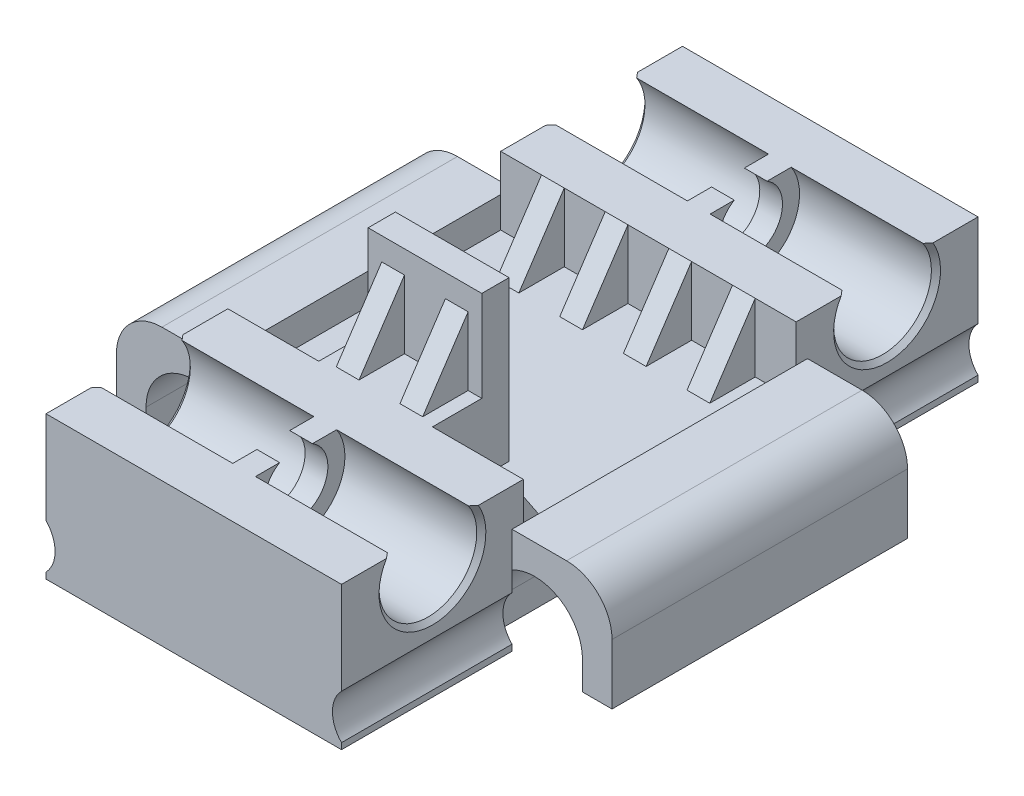
from build123d import *

# Parameters (mm, degrees)
SKETCH_1_W           = 65
SKETCH_1_H           = 140
EXTRUDE_1_DEPTH      = 31.5
SKETCH_2_R           = 10.75
CUT_EXTRUDE_1_DEPTH  = 30
CUT_EXTRUDE_START    = -30
SKETCH_3_R           = 10.75
CUT_EXTRUDE_2_DEPTH  = 30
CHAMFER_1_SIZE       = 1
CHAMFER_2_SIZE       = 1
SKETCH_4_W           = 25
SKETCH_4_H           = 6
EXTRUDE_2_DEPTH      = 20
EXTRUDE_4_DEPTH      = 2.5
EXTRUDE_5_DEPTH      = 2.5
CUT_EXTRUDE_3_DEPTH  = 15
EXTRUDE_6_DEPTH      = 2.5
EXTRUDE_7_DEPTH      = 2.5
EXTRUDE_8_DEPTH      = 2.5
EXTRUDE_9_DEPTH      = 2.5
EXTRUDE_10_DEPTH     = 5
EXTRUDE_11_DEPTH     = 5
SKETCH_18_R          = 7
CUT_EXTRUDE_7_DEPTH  = 94.686978818
SKETCH_19_W          = 65.000437226
SKETCH_19_H          = 23.25
EXTRUDE_12_DEPTH     = 22
SKETCH_20_W          = 65.000437226
SKETCH_20_H          = 23.25
EXTRUDE_13_DEPTH     = 22
CUT_EXTRUDE_8_DEPTH  = 30
SKETCH_22_R          = 7
CUT_EXTRUDE_9_DEPTH  = 159.815931191
CUT_EXTRUDE_10_DEPTH = 30
FILLET_7_R           = 10


with BuildPart() as part:
    # 草图1 → 凸台-拉伸1 (new body)
    with BuildSketch(Plane(origin=(0, 0, 0), x_dir=(1, 0, 0), z_dir=(0, 1, 0))):
        Rectangle(SKETCH_1_W, SKETCH_1_H)
    extrude(amount=EXTRUDE_1_DEPTH)

    # 草图2 → 切除-拉伸1 (cut)
    with BuildSketch(Plane.ZY.offset(32.5)):
        with Locations((-50, 25.5)):
            Circle(SKETCH_2_R)
        with Locations((50, 25.5)):
            Circle(SKETCH_2_R)
    extrude(amount=-CUT_EXTRUDE_1_DEPTH, mode=Mode.SUBTRACT)

    # 草图3 → 切除-拉伸2 (cut)
    with BuildSketch(Plane(origin=(32.5, 0, 0), x_dir=(0, 0, -1), z_dir=(1, 0, 0)).offset(CUT_EXTRUDE_START)):
        with Locations((-50, 25.5)):
            Circle(SKETCH_3_R)
        with Locations((50, 25.5)):
            Circle(SKETCH_3_R)
    extrude(amount=CUT_EXTRUDE_2_DEPTH, mode=Mode.SUBTRACT)

    # 倒角1
    chamfer_1_edges = [part.edges().sort_by_distance(p)[0] for p in [
        (32.5, 14.75, 50),
    ]]
    chamfer(chamfer_1_edges, length=CHAMFER_1_SIZE)

    # 倒角2
    chamfer_2_edges = [part.edges().sort_by_distance(p)[0] for p in [
        (-32.5, 14.75, -50),
        (-32.5, 14.75, 50),
        (32.5, 14.75, -50),
    ]]
    chamfer(chamfer_2_edges, length=CHAMFER_2_SIZE)

    # 草图4 → 凸台-拉伸2 (add)
    with BuildSketch(Plane(origin=(0, 31.5, 0), x_dir=(1, 0, 0), z_dir=(0, 1, 0))):
        with Locations((0, -16.15)):
            Rectangle(SKETCH_4_W, SKETCH_4_H)
    extrude(amount=EXTRUDE_2_DEPTH)

    # 草图7 → 凸台-拉伸4 (add, symmetric)
    with BuildSketch(Plane(origin=(7, 0, 0), x_dir=(0, 0, -1), z_dir=(1, 0, 0))):
        Polygon((-19.15, 46.5), (-19.15, 31.5), (-29.15, 31.5), align=None)
    extrude(amount=EXTRUDE_4_DEPTH, both=True)

    # 草图8 → 凸台-拉伸5 (add, symmetric)
    with BuildSketch(Plane(origin=(-7, 0, 0), x_dir=(0, 0, -1), z_dir=(1, 0, 0))):
        Polygon((-19.15, 46.5), (-19.15, 31.5), (-29.15, 31.5), align=None)
    extrude(amount=EXTRUDE_5_DEPTH, both=True)

    # 草图9 → 切除-拉伸3 (cut)
    with BuildSketch(Plane(origin=(0, 31.5, 0), x_dir=(1, 0, 0), z_dir=(0, 1, 0))):
        Polygon((-32.5, 30.000218613), (32.5, 30.000218613), (32.5, -13.15), (32.5, -30.000218613), (12.5, -30.000218613), (12.5, -13.15), (-12.5, -13.15), (-12.5, -30.000218613), (-32.5, -30.000218613), (-32.5, -13.15), align=None)
    extrude(amount=-CUT_EXTRUDE_3_DEPTH, mode=Mode.SUBTRACT)

    # 草图11 → 凸台-拉伸6 (add, symmetric)
    with BuildSketch(Plane(origin=(7, 0, 0), x_dir=(0, 0, -1), z_dir=(1, 0, 0))):
        Polygon((30.000218613, 31.5), (30.000218613, 16.5), (20.000218613, 16.5), align=None)
    extrude(amount=EXTRUDE_6_DEPTH, both=True)

    # 草图13 → 凸台-拉伸7 (add, symmetric)
    with BuildSketch(Plane(origin=(21, 0, 0), x_dir=(0, 0, -1), z_dir=(1, 0, 0))):
        Polygon((30.000218613, 31.5), (30.000218613, 16.5), (20.000218613, 16.5), align=None)
    extrude(amount=EXTRUDE_7_DEPTH, both=True)

    # 草图12 → 凸台-拉伸8 (add, symmetric)
    with BuildSketch(Plane(origin=(-7, 0, 0), x_dir=(0, 0, -1), z_dir=(1, 0, 0))):
        Polygon((30.000218613, 31.5), (30.000218613, 16.5), (20.000218613, 16.5), align=None)
    extrude(amount=EXTRUDE_8_DEPTH, both=True)

    # 草图14 → 凸台-拉伸9 (add, symmetric)
    with BuildSketch(Plane(origin=(-21, 0, 0), x_dir=(0, 0, -1), z_dir=(1, 0, 0))):
        Polygon((30.000218613, 31.5), (30.000218613, 16.5), (20.000218613, 16.5), align=None)
    extrude(amount=EXTRUDE_9_DEPTH, both=True)

    # 草图15 → 凸台-拉伸10 (add)
    with BuildSketch(Plane(origin=(-21, 0, 0), x_dir=(0, 0, -1), z_dir=(1, 0, 0))):
        Polygon((-30.000218613, 31.5), (-30.000218613, 16.5), (-20.000218613, 16.5), align=None)
    extrude(amount=-EXTRUDE_10_DEPTH)

    # 草图16 → 凸台-拉伸11 (add)
    with BuildSketch(Plane(origin=(21, 0, 0), x_dir=(0, 0, -1), z_dir=(1, 0, 0))):
        Polygon((-30.000218613, 31.5), (-30.000218613, 16.5), (-20.000218613, 16.5), align=None)
    extrude(amount=EXTRUDE_11_DEPTH)

    # 草图18 → 切除-拉伸7 (cut, through all)
    with BuildSketch(Plane.ZY.offset(2.5)):
        with Locations((50, 25.5)):
            Circle(SKETCH_18_R)
        with Locations((-50, 25.5)):
            Circle(SKETCH_18_R)
    extrude(amount=-CUT_EXTRUDE_7_DEPTH, mode=Mode.SUBTRACT)

    # 草图19 → 凸台-拉伸12 (add)
    with BuildSketch(Plane(origin=(32.5, 0, 0), x_dir=(0, 0, -1), z_dir=(1, 0, 0))):
        with Locations((0, 11.625)):
            Rectangle(SKETCH_19_W, SKETCH_19_H)
    extrude(amount=EXTRUDE_12_DEPTH)

    # 草图20 → 凸台-拉伸13 (add)
    with BuildSketch(Plane.ZY.offset(32.5)):
        with Locations((0, 11.625)):
            Rectangle(SKETCH_20_W, SKETCH_20_H)
    extrude(amount=EXTRUDE_13_DEPTH)

    # 草图21 → 切除-拉伸8 (cut)
    with BuildSketch(Plane.XY.offset(32.500218613)):
        with BuildLine():
            Line((-48, 6.25), (-48, 0))
            Line((-48, 0), (-27, 0))
            Line((-27, 0), (-27, 6.25))
            ThreePointArc((-27, 6.25), (-37.5, 16.75), (-48, 6.25))
        make_face()
        with BuildLine():
            Line((27, 6.25), (27, 0))
            Line((27, 0), (48, 0))
            Line((48, 0), (48, 6.25))
            ThreePointArc((48, 6.25), (37.5, 16.75), (27, 6.25))
        make_face()
    extrude(amount=-CUT_EXTRUDE_8_DEPTH, mode=Mode.SUBTRACT)

    # 草图22 → 切除-拉伸9 (cut, through all)
    with BuildSketch(Plane.XY.offset(70)):
        with Locations((-37.5, 6.25)):
            Circle(SKETCH_22_R)
        with Locations((37.5, 6.25)):
            Circle(SKETCH_22_R)
    extrude(amount=-CUT_EXTRUDE_9_DEPTH, mode=Mode.SUBTRACT)

    # 草图23 → 切除-拉伸10 (cut)
    with BuildSketch(Plane(origin=(0, 0, -32.500218613), x_dir=(-1, 0, 0), z_dir=(0, 0, -1)).offset(CUT_EXTRUDE_START)):
        with BuildLine():
            Line((-48, 6.25), (-48, 0))
            Line((-48, 0), (-27, 0))
            Line((-27, 0), (-27, 6.25))
            ThreePointArc((-27, 6.25), (-37.5, 16.75), (-48, 6.25))
        make_face()
        with BuildLine():
            Line((48, 6.25), (48, 0))
            Line((48, 0), (27, 0))
            Line((27, 0), (27, 6.25))
            ThreePointArc((27, 6.25), (37.5, 16.75), (48, 6.25))
        make_face()
    extrude(amount=CUT_EXTRUDE_10_DEPTH, mode=Mode.SUBTRACT)

    # 圆角7
    fillet_7_edges = [part.edges().sort_by_distance(p)[0] for p in [
        (54.5, 23.25, 0),
        (-54.5, 23.25, 0),
    ]]
    fillet(fillet_7_edges, radius=FILLET_7_R)


solid = part.part
